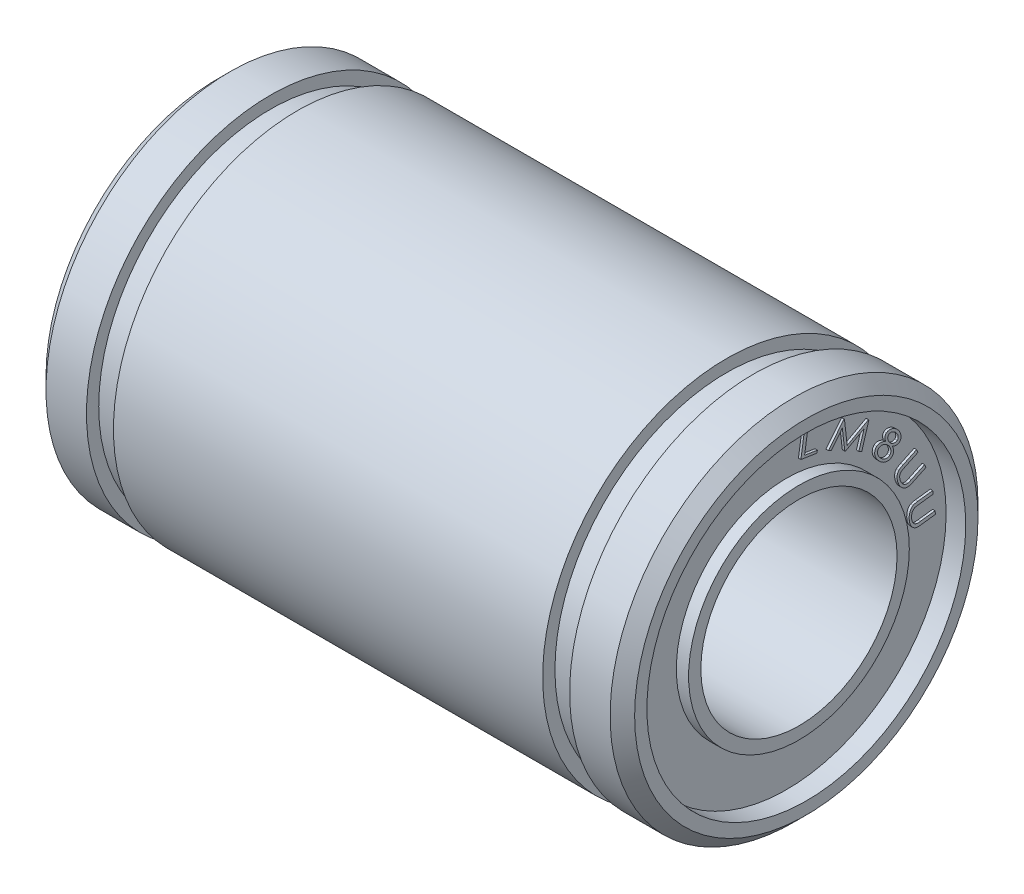
from build123d import *

# Parameters (mm, degrees)
SKETCH2_R                = 7.5
SKETCH2_R_2              = 6.5
BOSS_EXTRUDE1_DEPTH      = 12
BOSS_EXTRUDE2_DEPTH      = 11.2
BOSS_EXTRUDE2_DEPTH_BACK = 11.2
SKETCH3_R                = 6.5
SKETCH3_R_2              = 4.5
BOSS_EXTRUDE3_DEPTH      = 11.7
BOSS_EXTRUDE3_DEPTH_BACK = 11.7
SKETCH4_R                = 4.5
SKETCH4_R_2              = 4
CHAMFER1_SIZE            = 0.5
SKETCH5_W                = 1.1
SKETCH5_H                = 0.5
BOSS_EXTRUDE4_DEPTH      = 0.1
BOSS_EXTRUDE5_DEPTH      = 0.1


with BuildPart() as part:
    # Sketch2 → Boss-Extrude1 (new, symmetric)
    with BuildSketch(Plane(origin=(0, 0, 0), x_dir=(0, 0, -1), z_dir=(1, 0, 0))):
        Circle(SKETCH2_R)
        Circle(SKETCH2_R_2, mode=Mode.SUBTRACT)
    extrude(amount=BOSS_EXTRUDE1_DEPTH, both=True)

    # Sketch3 → Boss-Extrude2 (add, two sides: drawn at the far end of the back side and taken through both)
    with BuildSketch(Plane(origin=(0, 0, 0), x_dir=(0, 0, -1), z_dir=(1, 0, 0)).offset(-BOSS_EXTRUDE2_DEPTH_BACK)):
        Circle(SKETCH3_R)
        with Locations(Location((0, 0, 0), (0, 0, 180))):
            Circle(SKETCH3_R_2, mode=Mode.SUBTRACT)
    extrude(amount=BOSS_EXTRUDE2_DEPTH + BOSS_EXTRUDE2_DEPTH_BACK)

    # Sketch4 → Boss-Extrude3 (add, two sides: drawn at the far end of the back side and taken through both)
    with BuildSketch(Plane(origin=(0, 0, 0), x_dir=(0, 0, -1), z_dir=(1, 0, 0)).offset(-BOSS_EXTRUDE3_DEPTH_BACK)):
        Circle(SKETCH4_R)
        Circle(SKETCH4_R_2, mode=Mode.SUBTRACT)
    extrude(amount=BOSS_EXTRUDE3_DEPTH + BOSS_EXTRUDE3_DEPTH_BACK)

    # Chamfer1
    chamfer1_edges = [part.edges().sort_by_distance(p)[0] for p in [
        (-12, 0, 7.5),
        (12, 0, 7.5),
    ]]
    chamfer(chamfer1_edges, length=CHAMFER1_SIZE)

    # Sketch5 → Cut-Revolve1 (revolve, cut)
    with BuildSketch(Plane.XY, mode=Mode.PRIVATE) as cut_revolve1_sk:
        with Locations((-9.3, 7.25)):
            Rectangle(SKETCH5_W, SKETCH5_H)
        with Locations((9.3, 7.25)):
            Rectangle(SKETCH5_W, SKETCH5_H)
    revolve(cut_revolve1_sk.sketch.rotate(Axis((12, 0, 0), (-1, 0, 0)), 90), axis=Axis((12, 0, 0), (-1, 0, 0)), mode=Mode.SUBTRACT)

    # Sketch6 → Boss-Extrude4 (add)
    # profile 1 of 5: a face of its own
    with BuildSketch(Plane.ZY.offset(11.2)):
        with BuildLine():
            Line((5.852783603, 1.183430266), (5.869610526, 1.0480136))
            Line((5.869610526, 1.0480136), (5.274658603, 0.97389501))
            add(Edge.make_bspline(
                [(5.274658603, 0.97389501), (5.266240128, 0.972863919), (5.250257189, 0.970906336), (5.227658416, 0.967557015), (5.207525068, 0.964862618), (5.189882151, 0.962109642), (5.174767594, 0.959194656), (5.162086399, 0.956951994), (5.152002622, 0.954552314), (5.146180552, 0.952815346), (5.143648987, 0.952060074)],
                knots=[0, 0, 0, 0, 1.531157103, 2.906986272, 4.124266478, 5.198468333, 6.130081346, 6.903215753, 7.523093966, 8, 8, 8, 8], degree=3))
            add(Edge.make_bspline(
                [(5.143648987, 0.952060074), (5.13453567, 0.948898083), (5.116662917, 0.942696886), (5.091961703, 0.929394764), (5.070374356, 0.912652276), (5.050962157, 0.893134808), (5.03456001, 0.869303997), (5.020789861, 0.8409394), (5.00912617, 0.807993132), (4.999809419, 0.771164662), (4.99312128, 0.732178096), (4.989475431, 0.692667611), (4.989082053, 0.653363647), (4.991700096, 0.627460269), (4.993007962, 0.61452001)],
                knots=[0, 0, 0, 0, 0.863893486, 1.694240831, 2.501235341, 3.305538788, 4.152486817, 5.081460783, 6.124810033, 7.280534857, 8.483167108, 9.667377421, 10.834718017, 12, 12, 12, 12], degree=3))
            add(Edge.make_bspline(
                [(4.993007962, 0.61452001), (4.994614029, 0.603464762), (4.997804354, 0.58150438), (5.006041916, 0.549398247), (5.016377661, 0.518189175), (5.02936743, 0.488423533), (5.044177601, 0.460423412), (5.061137472, 0.435080624), (5.079540286, 0.412239037), (5.099817135, 0.392304951), (5.121850981, 0.37535501), (5.145311174, 0.361231075), (5.170454712, 0.350220592), (5.188050201, 0.345346398), (5.196934244, 0.342885395)],
                knots=[0, 0, 0, 0, 1.112395204, 2.209685604, 3.297434079, 4.38510116, 5.441803612, 6.449333861, 7.418822686, 8.359788486, 9.275360939, 10.182481772, 11.082326805, 12, 12, 12, 12], degree=3))
            add(Edge.make_bspline(
                [(5.196934244, 0.342885395), (5.200596565, 0.342148157), (5.208665862, 0.34052378), (5.222156771, 0.339518888), (5.237998971, 0.339129296), (5.256238627, 0.339652533), (5.276949187, 0.34061766), (5.30006052, 0.342451261), (5.325558236, 0.345124637), (5.343304037, 0.347205808), (5.352583282, 0.348294048)],
                knots=[0, 0, 0, 0, 0.573153494, 1.262845552, 2.073082706, 3.006320223, 4.063610556, 5.256519096, 6.565439054, 8, 8, 8, 8], degree=3))
            Line((5.352583282, 0.348294048), (5.947535205, 0.422412638))
            Line((5.947535205, 0.422412638), (5.964562449, 0.286995971))
            Line((5.964562449, 0.286995971), (5.369610526, 0.212877382))
            add(Edge.make_bspline(
                [(5.369610526, 0.212877382), (5.358867234, 0.211671284), (5.337878524, 0.209314984), (5.307076459, 0.207058106), (5.277668671, 0.20630151), (5.249720866, 0.20657026), (5.22318557, 0.208444379), (5.198077279, 0.211318556), (5.174418047, 0.21580393), (5.151903857, 0.221301845), (5.130261232, 0.228836367), (5.109219219, 0.238640728), (5.088731412, 0.25102273), (5.068626497, 0.265565571), (5.048803425, 0.282224344), (5.029280563, 0.301070608), (5.01048668, 0.322541289), (4.991984387, 0.345880789), (4.974508177, 0.371299576), (4.958805909, 0.398567772), (4.944418917, 0.427317135), (4.932055923, 0.457817415), (4.921492575, 0.489974926), (4.912412013, 0.523722563), (4.905253391, 0.559135723), (4.901807833, 0.58338407), (4.900059244, 0.595689882)],
                knots=[0, 0, 0, 0, 1.12111868, 2.190281572, 3.201706995, 4.171302125, 5.087520792, 5.959352604, 6.790580153, 7.583330775, 8.360811272, 9.163212158, 9.986235793, 10.839554322, 11.734190068, 12.66957423, 13.650674517, 14.691104165, 15.757145209, 16.846304983, 17.951917626, 19.088710513, 20.255912591, 21.460320474, 22.711136217, 24, 24, 24, 24], degree=3))
            add(Edge.make_bspline(
                [(4.900059244, 0.595689882), (4.898606441, 0.609100804), (4.895748899, 0.635478972), (4.893541604, 0.674586352), (4.89330056, 0.712430643), (4.895072076, 0.749084489), (4.898905548, 0.784453002), (4.904412906, 0.818601194), (4.91210339, 0.851444299), (4.921594426, 0.88292633), (4.93301684, 0.912667227), (4.945726797, 0.940391544), (4.960113694, 0.965768933), (4.975518983, 0.989146276), (4.993033672, 1.0098598), (5.011582319, 1.028590221), (5.031718684, 1.045020841), (5.046258343, 1.054103757), (5.053504757, 1.058630587)],
                knots=[0, 0, 0, 0, 1.25771018, 2.473811262, 3.650639431, 4.785250235, 5.893675183, 6.9664446, 8.008582003, 9.036768308, 10.030088047, 10.977255682, 11.877778809, 12.748155901, 13.583646823, 14.402569918, 15.203857571, 16, 16, 16, 16], degree=3))
            add(Edge.make_bspline(
                [(5.053504757, 1.058630587), (5.058460561, 1.061345871), (5.069099058, 1.067174702), (5.087388125, 1.074085539), (5.108458163, 1.081185509), (5.132555795, 1.087667958), (5.15966221, 1.093597317), (5.189619906, 1.099482934), (5.222732687, 1.104538275), (5.245807995, 1.107676477), (5.25783168, 1.109311677)],
                knots=[0, 0, 0, 0, 0.64015188, 1.374197451, 2.212343233, 3.162107618, 4.201971045, 5.358912142, 6.623827319, 8, 8, 8, 8], degree=3))
            Line((5.25783168, 1.109311677), (5.852783603, 1.183430266))
        make_face()
    # profile 2 of 5: a face of its own
    with BuildSketch(Plane.ZY.offset(11.2)):
        with BuildLine():
            Line((5.1949903, 2.954849137), (5.253083249, 2.831652022))
            Line((5.253083249, 2.831652022), (4.708211454, 2.574039842))
            add(Edge.make_bspline(
                [(4.708211454, 2.574039842), (4.700525688, 2.570381353), (4.685936805, 2.563436921), (4.665277867, 2.553337005), (4.64686738, 2.544483857), (4.630942378, 2.536193542), (4.617363008, 2.528765851), (4.606009362, 2.522475578), (4.597000085, 2.51706862), (4.592008201, 2.513502324), (4.589822031, 2.511940483)],
                knots=[0, 0, 0, 0, 1.526601971, 2.897748655, 4.124244775, 5.190145003, 6.117233676, 6.90006029, 7.518286969, 8, 8, 8, 8], degree=3))
            add(Edge.make_bspline(
                [(4.589822031, 2.511940483), (4.58208983, 2.506078947), (4.566968017, 2.494615582), (4.547746721, 2.473987106), (4.531983511, 2.451518254), (4.519809783, 2.426621708), (4.511576749, 2.398817195), (4.507197424, 2.367532764), (4.506062292, 2.332548704), (4.508861449, 2.29461771), (4.514709721, 2.255490067), (4.523809404, 2.216856999), (4.535647214, 2.179437906), (4.546134945, 2.155619154), (4.551360493, 2.143751381)],
                knots=[0, 0, 0, 0, 0.867002332, 1.695590419, 2.511190631, 3.315637339, 4.164470842, 5.09494713, 6.135349929, 7.291287823, 8.493904131, 9.672344479, 10.840237755, 12, 12, 12, 12], degree=3))
            add(Edge.make_bspline(
                [(4.551360493, 2.143751381), (4.556390688, 2.133702323), (4.5663414, 2.113823316), (4.584333989, 2.085871772), (4.603784295, 2.059372583), (4.625427507, 2.035030983), (4.648333584, 2.013050594), (4.672637656, 1.994438798), (4.697199699, 1.978300582), (4.722834629, 1.965908507), (4.749053316, 1.956450992), (4.775944377, 1.950803306), (4.803383103, 1.947890299), (4.821723246, 1.948919468), (4.831007929, 1.949440483)],
                knots=[0, 0, 0, 0, 1.115688134, 2.207049909, 3.297665439, 4.378553269, 5.439054465, 6.446196602, 7.415962669, 8.35349526, 9.268291365, 10.177804537, 11.077515089, 12, 12, 12, 12], degree=3))
            add(Edge.make_bspline(
                [(4.831007929, 1.949440483), (4.834762282, 1.949894682), (4.843023816, 1.950894155), (4.856179118, 1.954429466), (4.871586823, 1.958687976), (4.888768805, 1.965092281), (4.9082489, 1.972513533), (4.929679079, 1.981498306), (4.953213785, 1.992005649), (4.969506099, 1.999565631), (4.978043185, 2.003527022)],
                knots=[0, 0, 0, 0, 0.576626743, 1.268879095, 2.075383897, 3.016827495, 4.065561191, 5.25819098, 6.563306669, 8, 8, 8, 8], degree=3))
            Line((4.978043185, 2.003527022), (5.52291498, 2.261139201))
            Line((5.52291498, 2.261139201), (5.581208249, 2.137942086))
            Line((5.581208249, 2.137942086), (5.036336454, 1.880329906))
            add(Edge.make_bspline(
                [(5.036336454, 1.880329906), (5.026486559, 1.875782417), (5.007201544, 1.866878932), (4.978411586, 1.855081114), (4.950614437, 1.845028535), (4.923711689, 1.836782543), (4.897886145, 1.829922803), (4.872944073, 1.824831179), (4.848978078, 1.821645951), (4.825765416, 1.819901881), (4.802808619, 1.820207044), (4.779754763, 1.823175696), (4.756359877, 1.828166998), (4.73256424, 1.835456479), (4.708500054, 1.845087508), (4.684201705, 1.857334618), (4.659347278, 1.871471926), (4.634446015, 1.888062398), (4.6098916, 1.906790794), (4.586239106, 1.927650315), (4.563680759, 1.950558009), (4.542519128, 1.975743702), (4.52215442, 2.002790968), (4.503255072, 2.032172478), (4.485084338, 2.063369036), (4.474305393, 2.085321399), (4.468828441, 2.09647574)],
                knots=[0, 0, 0, 0, 1.122329607, 2.197398293, 3.217899131, 4.179380452, 5.107677168, 5.981552748, 6.811047209, 7.607430596, 8.38819948, 9.181671035, 10.008197087, 10.860479187, 11.753345179, 12.686385394, 13.673510063, 14.710088981, 15.779549503, 16.866164986, 17.970209254, 19.102445698, 20.26719891, 21.470546206, 22.714744744, 24, 24, 24, 24], degree=3))
            add(Edge.make_bspline(
                [(4.468828441, 2.09647574), (4.463236837, 2.108778742), (4.452247051, 2.132959165), (4.438003032, 2.169532685), (4.426027259, 2.205515969), (4.416022352, 2.240897488), (4.408696016, 2.275719226), (4.403385384, 2.309952665), (4.400377454, 2.343609942), (4.399547642, 2.376533499), (4.400902354, 2.408332425), (4.404430057, 2.438619807), (4.410278504, 2.467214077), (4.418089471, 2.494154182), (4.427812027, 2.519530685), (4.439945774, 2.543020554), (4.453937899, 2.564977394), (4.465067018, 2.578097216), (4.470631326, 2.58465683)],
                knots=[0, 0, 0, 0, 1.258098567, 2.47267724, 3.652303055, 4.788141768, 5.894117424, 6.963326746, 8.011966988, 9.038102082, 10.027590266, 10.973030082, 11.87409143, 12.741760367, 13.582275377, 14.399756918, 15.199914691, 16, 16, 16, 16], degree=3))
            add(Edge.make_bspline(
                [(4.470631326, 2.58465683), (4.474554723, 2.588818637), (4.482969471, 2.597744718), (4.498333358, 2.610123911), (4.516092249, 2.623727072), (4.537194851, 2.637324731), (4.561166017, 2.651647235), (4.588184165, 2.666306391), (4.618068893, 2.681808181), (4.639139434, 2.691951601), (4.650118505, 2.697236958)],
                knots=[0, 0, 0, 0, 0.643772035, 1.380736863, 2.21890818, 3.16423712, 4.206842921, 5.365167413, 6.627087258, 8, 8, 8, 8], degree=3))
            Line((4.650118505, 2.697236958), (5.1949903, 2.954849137))
        make_face()
    # profile 3 of 5: a face of its own
    with BuildSketch(Plane.ZY.offset(11.2)):
        with BuildLine():
            add(Edge.make_bspline(
                [(4.210172993, 3.574370887), (4.214630345, 3.563397169), (4.223284446, 3.542091321), (4.233948563, 3.510372512), (4.243088319, 3.480357414), (4.250230657, 3.451758141), (4.25514951, 3.424576938), (4.258592429, 3.398916083), (4.259525833, 3.37471957), (4.258792779, 3.35194566), (4.256240779, 3.330411397), (4.251734084, 3.309997219), (4.245778041, 3.290532472), (4.23811036, 3.272037388), (4.228973264, 3.25447204), (4.217707798, 3.238212337), (4.205183992, 3.222591846), (4.195459976, 3.213290326), (4.190541582, 3.20858563)],
                knots=[0, 0, 0, 0, 1.44955035, 2.814351453, 4.094403086, 5.289816763, 6.420076562, 7.474462587, 8.456167334, 9.380383044, 10.261408924, 11.106318522, 11.936229004, 12.749838444, 13.554239798, 14.354519299, 15.167718053, 16, 16, 16, 16], degree=3))
            add(Edge.make_bspline(
                [(4.190541582, 3.20858563), (4.183342877, 3.202384215), (4.169062415, 3.190082131), (4.145181125, 3.175108072), (4.119906819, 3.162967004), (4.093104759, 3.153689379), (4.064726208, 3.147497624), (4.034845663, 3.144419212), (4.003443768, 3.143885949), (3.98213011, 3.146001434), (3.971190621, 3.147087233)],
                knots=[0, 0, 0, 0, 0.967600255, 1.919481046, 2.863440767, 3.821533868, 4.804390076, 5.817846704, 6.879983798, 8, 8, 8, 8], degree=3))
            add(Edge.make_bspline(
                [(3.971190621, 3.147087233), (3.957429969, 3.149227449), (3.929667243, 3.15354543), (3.888707875, 3.166271967), (3.847929142, 3.183264625), (3.807539098, 3.205471574), (3.767163762, 3.231908882), (3.727268162, 3.263458703), (3.687513706, 3.299547486), (3.662255398, 3.326265782), (3.649275557, 3.339995887)],
                knots=[0, 0, 0, 0, 0.871235448, 1.757756195, 2.678197, 3.634502803, 4.640226112, 5.697766159, 6.816918833, 8, 8, 8, 8], degree=3))
            add(Edge.make_bspline(
                [(3.649275557, 3.339995887), (3.637141026, 3.353666176), (3.613619081, 3.380165081), (3.582372553, 3.421222193), (3.555242819, 3.461462858), (3.532939632, 3.501437136), (3.514947983, 3.540798181), (3.501284946, 3.57963809), (3.492376441, 3.618076959), (3.488082798, 3.655719102), (3.487326545, 3.691853712), (3.489383952, 3.725995436), (3.494600947, 3.757870852), (3.502600393, 3.787492684), (3.513324583, 3.814980497), (3.527369194, 3.839977012), (3.543962561, 3.863024373), (3.557393993, 3.876231685), (3.564139339, 3.882864476)],
                knots=[0, 0, 0, 0, 1.44102328, 2.793323338, 4.065377375, 5.265249014, 6.398752964, 7.474536514, 8.506634203, 9.503347757, 10.456678685, 11.353725829, 12.196901549, 12.999110117, 13.769636829, 14.516870557, 15.255163551, 16, 16, 16, 16], degree=3))
            add(Edge.make_bspline(
                [(3.564139339, 3.882864476), (3.569323982, 3.887386128), (3.579621339, 3.896366699), (3.59656267, 3.907729136), (3.614347002, 3.917410122), (3.632930501, 3.925518333), (3.652537118, 3.931418914), (3.672878097, 3.935928427), (3.694211395, 3.938490321), (3.716516598, 3.939219033), (3.739997294, 3.938343427), (3.764670679, 3.934681648), (3.790786362, 3.929307755), (3.818260485, 3.921587626), (3.847137412, 3.911728353), (3.877294743, 3.899628826), (3.90897296, 3.885602827), (3.930174203, 3.874820735), (3.941142544, 3.869242681)],
                knots=[0, 0, 0, 0, 0.817538492, 1.62373468, 2.419814391, 3.223817057, 4.030169697, 4.851095687, 5.699229519, 6.581337039, 7.503436561, 8.489558822, 9.544019967, 10.673119246, 11.881128513, 13.171536168, 14.53671057, 16, 16, 16, 16], degree=3))
            add(Edge.make_bspline(
                [(3.941142544, 3.869242681), (3.938065934, 3.877363479), (3.932056255, 3.893226193), (3.924435861, 3.916957067), (3.918184666, 3.939864355), (3.913539156, 3.962079817), (3.910335037, 3.983482198), (3.908419246, 4.004152022), (3.908265137, 4.024041289), (3.909404504, 4.043132547), (3.912061476, 4.061328346), (3.915737269, 4.078671327), (3.921139386, 4.094916886), (3.927120789, 4.110430365), (3.934952708, 4.124732974), (3.943650329, 4.138178351), (3.953804594, 4.150538773), (3.961372458, 4.157970563), (3.965181006, 4.16171063)],
                knots=[0, 0, 0, 0, 1.334713297, 2.607154434, 3.829682964, 4.983172095, 6.093662305, 7.154912732, 8.171129541, 9.148180218, 10.091713838, 10.99572943, 11.868918541, 12.720916661, 13.547494991, 14.370240634, 15.179819431, 16, 16, 16, 16], degree=3))
            add(Edge.make_bspline(
                [(3.965181006, 4.16171063), (3.969314154, 4.165276513), (3.97757301, 4.17240186), (3.991321665, 4.181432158), (4.006118686, 4.188964762), (4.021720329, 4.195814204), (4.038702345, 4.200558014), (4.056510776, 4.204713334), (4.075421795, 4.207265718), (4.095237496, 4.208359348), (4.115651546, 4.208477449), (4.136480051, 4.206821564), (4.157538096, 4.203537858), (4.178885106, 4.198962806), (4.200448609, 4.192936487), (4.222168574, 4.185242955), (4.244137988, 4.176008565), (4.27389278, 4.161768381), (4.310542712, 4.141122241), (4.352346035, 4.111519728), (4.392492978, 4.077990149), (4.416807877, 4.052450756), (4.429123313, 4.039515117)],
                knots=[0, 0, 0, 0, 0.622034245, 1.242948883, 1.869626625, 2.514544104, 3.181907857, 3.876518595, 4.599114658, 5.354354804, 6.138670592, 6.925348559, 7.734123211, 8.567508609, 9.413701997, 10.285512202, 11.193421449, 12.130062518, 14.046446254, 15.981543311, 17.964661662, 20, 20, 20, 20], degree=3))
            add(Edge.make_bspline(
                [(4.429123313, 4.039515117), (4.440539519, 4.026438616), (4.463072838, 4.000628202), (4.491841192, 3.95876655), (4.516117582, 3.915375589), (4.535630256, 3.870905213), (4.550038334, 3.826345413), (4.559206403, 3.782695575), (4.56223375, 3.740390328), (4.560214213, 3.706237009), (4.555565386, 3.680270896), (4.551035584, 3.661903719), (4.545246251, 3.644597619), (4.538123045, 3.628420099), (4.530000287, 3.61320384), (4.520495207, 3.599026754), (4.509671841, 3.586013522), (4.501640252, 3.578112663), (4.497632929, 3.574170566)],
                knots=[0, 0, 0, 0, 1.60990914, 3.177640475, 4.703475317, 6.218639192, 7.676713618, 9.042755577, 10.347441643, 11.601825723, 12.205993714, 12.793664293, 13.356091324, 13.897221279, 14.432356731, 14.954856267, 15.478530456, 16, 16, 16, 16], degree=3))
            add(Edge.make_bspline(
                [(4.497632929, 3.574170566), (4.493419574, 3.570556304), (4.485014889, 3.563346674), (4.471433901, 3.553951253), (4.45709876, 3.546114653), (4.442157674, 3.539643908), (4.426541847, 3.534584289), (4.41012772, 3.53129907), (4.393137163, 3.528971725), (4.375430191, 3.52848456), (4.357088279, 3.529297565), (4.338080933, 3.531530302), (4.318413891, 3.535164855), (4.298095681, 3.540238343), (4.27704384, 3.546683598), (4.255252334, 3.554502399), (4.232783088, 3.56370719), (4.217821373, 3.570763648), (4.210172993, 3.574370887)],
                knots=[0, 0, 0, 0, 0.869282886, 1.734021791, 2.581439237, 3.424843839, 4.281700514, 5.147514454, 6.044126873, 6.965242563, 7.91812612, 8.918574964, 9.960916807, 11.049378877, 12.197677358, 13.408732993, 14.675352794, 16, 16, 16, 16], degree=3))
        make_face()
        with BuildLine():
            add(Edge.make_bspline(
                [(4.353201839, 3.979018322), (4.346925732, 3.985628126), (4.334630089, 3.998577519), (4.315405271, 4.016505142), (4.295686675, 4.032286509), (4.275848562, 4.046538909), (4.255450136, 4.058433942), (4.234849767, 4.068596192), (4.213945778, 4.07684079), (4.19290545, 4.083193932), (4.172274461, 4.087645729), (4.152540546, 4.08988211), (4.133943063, 4.090141605), (4.116358626, 4.08842822), (4.099908365, 4.084428401), (4.084579947, 4.078331855), (4.07039931, 4.070072485), (4.061978142, 4.063076915), (4.057729082, 4.059547169)],
                knots=[0, 0, 0, 0, 1.298124085, 2.543179939, 3.740382283, 4.893556371, 6.019061523, 7.09945913, 8.162682028, 9.215774896, 10.226797017, 11.164717978, 12.039772105, 12.871635768, 13.674391456, 14.442657599, 15.214213473, 16, 16, 16, 16], degree=3))
            add(Edge.make_bspline(
                [(4.057729082, 4.059547169), (4.053861336, 4.055650668), (4.046098095, 4.047829713), (4.036733985, 4.034035555), (4.029182717, 4.018821693), (4.023861395, 4.001979593), (4.020227439, 3.983644893), (4.018720507, 3.963687279), (4.019170816, 3.942229093), (4.021676472, 3.919611611), (4.025678893, 3.896446337), (4.032043167, 3.873605591), (4.039829303, 3.851202938), (4.049540827, 3.829338194), (4.060829951, 3.80783548), (4.074511456, 3.787241198), (4.089463783, 3.766839786), (4.100700148, 3.753979433), (4.106406967, 3.74744781)],
                knots=[0, 0, 0, 0, 0.762191197, 1.529850645, 2.306501283, 3.117057933, 3.9785243, 4.900907606, 5.894761445, 6.959297982, 8.063208751, 9.160340868, 10.252943674, 11.359000803, 12.484880561, 13.625977656, 14.794261766, 16, 16, 16, 16], degree=3))
            add(Edge.make_bspline(
                [(4.106406967, 3.74744781), (4.114065441, 3.739472531), (4.129285832, 3.723622526), (4.154655496, 3.702902857), (4.181500114, 3.684660153), (4.209660622, 3.669367621), (4.238426042, 3.657352673), (4.267125899, 3.649129876), (4.295303565, 3.645096099), (4.322526351, 3.644847969), (4.348041647, 3.648139513), (4.371077363, 3.654723805), (4.391590717, 3.664273109), (4.402906106, 3.673421714), (4.4084903, 3.677936592)],
                knots=[0, 0, 0, 0, 1.169442566, 2.324141052, 3.459139556, 4.600808126, 5.709896512, 6.752567757, 7.752091318, 8.71332435, 9.625933698, 10.464729916, 11.242337406, 12, 12, 12, 12], degree=3))
            add(Edge.make_bspline(
                [(4.4084903, 3.677936592), (4.412091359, 3.68143116), (4.41927742, 3.688404716), (4.427828648, 3.700976628), (4.435139864, 3.714543039), (4.440526791, 3.72961943), (4.444292028, 3.745888323), (4.446474392, 3.763476113), (4.446989517, 3.782378079), (4.446041767, 3.802492462), (4.443064967, 3.823521027), (4.437659736, 3.845045312), (4.429448399, 3.866666972), (4.419216716, 3.88871679), (4.406225598, 3.910907059), (4.39102677, 3.93361481), (4.373069115, 3.956390404), (4.359949483, 3.971333064), (4.353201839, 3.979018322)],
                knots=[0, 0, 0, 0, 0.711682619, 1.420192318, 2.15062308, 2.898429337, 3.688260017, 4.520754515, 5.413581114, 6.373580811, 7.380499643, 8.428125446, 9.521466003, 10.663903564, 11.880271886, 13.173072711, 14.546064374, 16, 16, 16, 16], degree=3))
        make_face(mode=Mode.SUBTRACT)
        with BuildLine():
            add(Edge.make_bspline(
                [(4.04110248, 3.685348451), (4.033186632, 3.693658053), (4.017672817, 3.709943565), (3.993128412, 3.732337379), (3.967869862, 3.752093819), (3.942198881, 3.769780032), (3.915678694, 3.784510242), (3.88868001, 3.797101945), (3.861073151, 3.807137452), (3.8331414, 3.814433238), (3.805822642, 3.819444996), (3.779607944, 3.822028794), (3.754882349, 3.821639344), (3.731607608, 3.818689078), (3.709785376, 3.813060748), (3.689370218, 3.804852268), (3.670488954, 3.793797527), (3.659431981, 3.784410423), (3.653882929, 3.779699412)],
                knots=[0, 0, 0, 0, 1.255674536, 2.460924376, 3.631837996, 4.762760054, 5.868544453, 6.947443884, 8.019989786, 9.078125997, 10.102937184, 11.056915449, 11.955823424, 12.803272986, 13.618544949, 14.415066428, 15.204585384, 16, 16, 16, 16], degree=3))
            add(Edge.make_bspline(
                [(3.653882929, 3.779699412), (3.64755204, 3.773166319), (3.634863259, 3.760072266), (3.620178564, 3.736206736), (3.610173044, 3.708995836), (3.603767779, 3.679128327), (3.601720133, 3.647107976), (3.60502786, 3.61369414), (3.612703815, 3.579235324), (3.625343959, 3.543962844), (3.642348951, 3.508167539), (3.664099626, 3.472487777), (3.689674483, 3.436547623), (3.709685951, 3.413936648), (3.719988698, 3.402295566)],
                knots=[0, 0, 0, 0, 0.771791342, 1.546874631, 2.3608388, 3.226012444, 4.136118452, 5.076700301, 6.071162967, 7.130513777, 8.255465151, 9.434509802, 10.679177577, 12, 12, 12, 12], degree=3))
            add(Edge.make_bspline(
                [(3.719988698, 3.402295566), (3.728298296, 3.393510364), (3.744533662, 3.376345759), (3.77001361, 3.352998746), (3.795405038, 3.332058278), (3.821489153, 3.314520988), (3.847390925, 3.299066178), (3.873751262, 3.286865215), (3.900222779, 3.277301649), (3.926676094, 3.270578987), (3.952554483, 3.266348868), (3.977383192, 3.264636789), (4.000826906, 3.265617018), (4.02295064, 3.269001037), (4.043739807, 3.274849652), (4.063292788, 3.283002679), (4.081453937, 3.293962285), (4.092169722, 3.303113137), (4.097592865, 3.307744284)],
                knots=[0, 0, 0, 0, 1.347039667, 2.631857821, 3.848511206, 5.010397929, 6.130830263, 7.20602828, 8.241569092, 9.262979973, 10.242784583, 11.159900389, 12.031234029, 12.852053592, 13.648222388, 14.431775035, 15.20633839, 16, 16, 16, 16], degree=3))
            add(Edge.make_bspline(
                [(4.097592865, 3.307744284), (4.102503395, 3.312537637), (4.112329123, 3.322128898), (4.124038712, 3.339219557), (4.133565821, 3.357790504), (4.140642817, 3.378144974), (4.145168288, 3.400237482), (4.147243468, 3.424080254), (4.147304718, 3.449636744), (4.144515775, 3.476548035), (4.139886575, 3.504189407), (4.132583276, 3.531631394), (4.123154752, 3.558657749), (4.111283295, 3.585086021), (4.097150342, 3.611021987), (4.080923159, 3.636529889), (4.062214026, 3.66149311), (4.048227644, 3.677297254), (4.04110248, 3.685348451)],
                knots=[0, 0, 0, 0, 0.784478123, 1.569701805, 2.359976643, 3.170430092, 4.030075566, 4.936633935, 5.908124575, 6.953203035, 8.03222106, 9.115784845, 10.202045408, 11.308057782, 12.430768399, 13.583032808, 14.768710361, 16, 16, 16, 16], degree=3))
        make_face(mode=Mode.SUBTRACT)
    # profile 4 of 5: a face of its own
    with BuildSketch(Plane.ZY.offset(11.2)):
        Polygon((1.601520085, 4.718597961), (2.234933546, 5.513069115), (2.254564957, 5.502852769), (2.365742841, 4.521081935), (3.230526495, 4.992436102), (3.250157905, 4.982219756), (2.961095405, 4.007660461), (2.842105021, 4.06996014), (3.054645085, 4.763870397), (2.297633867, 4.354615589), (2.267385469, 4.37044091), (2.168226815, 5.233421679), (1.717906303, 4.657700525), align=None)
    # profile 5 of 5: a face of its own
    with BuildSketch(Plane.ZY.offset(11.2)):
        Polygon((0.628059226, 5.950645023), (0.764277175, 5.93001201), (0.62966179, 5.039787651), (1.149693841, 4.961061689), (1.135270764, 4.865909446), (0.479020764, 4.96526842), align=None)
    extrude(amount=BOSS_EXTRUDE4_DEPTH)

    # Sketch7 → Boss-Extrude5 (add)
    # profile 1 of 5: a face of its own
    with BuildSketch(Plane(origin=(11.2, 0, 0), x_dir=(0, 0, -1), z_dir=(1, 0, 0))):
        with BuildLine():
            Line((5.852783603, 1.183430266), (5.869610526, 1.0480136))
            Line((5.869610526, 1.0480136), (5.274658603, 0.97389501))
            add(Edge.make_bspline(
                [(5.274658603, 0.97389501), (5.266240128, 0.972863919), (5.250257189, 0.970906336), (5.227658416, 0.967557015), (5.207525068, 0.964862618), (5.189882151, 0.962109642), (5.174767594, 0.959194656), (5.162086399, 0.956951994), (5.152002622, 0.954552314), (5.146180552, 0.952815346), (5.143648987, 0.952060074)],
                knots=[0, 0, 0, 0, 1.531157103, 2.906986272, 4.124266478, 5.198468333, 6.130081346, 6.903215753, 7.523093966, 8, 8, 8, 8], degree=3))
            add(Edge.make_bspline(
                [(5.143648987, 0.952060074), (5.13453567, 0.948898083), (5.116662917, 0.942696886), (5.091961703, 0.929394764), (5.070374356, 0.912652276), (5.050962157, 0.893134808), (5.03456001, 0.869303997), (5.020789861, 0.8409394), (5.00912617, 0.807993132), (4.999809419, 0.771164662), (4.99312128, 0.732178096), (4.989475431, 0.692667611), (4.989082053, 0.653363647), (4.991700096, 0.627460269), (4.993007962, 0.61452001)],
                knots=[0, 0, 0, 0, 0.863893486, 1.694240831, 2.501235341, 3.305538788, 4.152486817, 5.081460783, 6.124810033, 7.280534857, 8.483167108, 9.667377421, 10.834718017, 12, 12, 12, 12], degree=3))
            add(Edge.make_bspline(
                [(4.993007962, 0.61452001), (4.994614029, 0.603464762), (4.997804354, 0.58150438), (5.006041916, 0.549398247), (5.016377661, 0.518189175), (5.02936743, 0.488423533), (5.044177601, 0.460423412), (5.061137472, 0.435080624), (5.079540286, 0.412239037), (5.099817135, 0.392304951), (5.121850981, 0.37535501), (5.145311174, 0.361231075), (5.170454712, 0.350220592), (5.188050201, 0.345346398), (5.196934244, 0.342885395)],
                knots=[0, 0, 0, 0, 1.112395204, 2.209685604, 3.297434079, 4.38510116, 5.441803612, 6.449333861, 7.418822686, 8.359788486, 9.275360939, 10.182481772, 11.082326805, 12, 12, 12, 12], degree=3))
            add(Edge.make_bspline(
                [(5.196934244, 0.342885395), (5.200596565, 0.342148157), (5.208665862, 0.34052378), (5.222156771, 0.339518888), (5.237998971, 0.339129296), (5.256238627, 0.339652533), (5.276949187, 0.34061766), (5.30006052, 0.342451261), (5.325558236, 0.345124637), (5.343304037, 0.347205808), (5.352583282, 0.348294048)],
                knots=[0, 0, 0, 0, 0.573153494, 1.262845552, 2.073082706, 3.006320223, 4.063610556, 5.256519096, 6.565439054, 8, 8, 8, 8], degree=3))
            Line((5.352583282, 0.348294048), (5.947535205, 0.422412638))
            Line((5.947535205, 0.422412638), (5.964562449, 0.286995971))
            Line((5.964562449, 0.286995971), (5.369610526, 0.212877382))
            add(Edge.make_bspline(
                [(5.369610526, 0.212877382), (5.358867234, 0.211671284), (5.337878524, 0.209314984), (5.307076459, 0.207058106), (5.277668671, 0.20630151), (5.249720866, 0.20657026), (5.22318557, 0.208444379), (5.198077279, 0.211318556), (5.174418047, 0.21580393), (5.151903857, 0.221301845), (5.130261232, 0.228836367), (5.109219219, 0.238640728), (5.088731412, 0.25102273), (5.068626497, 0.265565571), (5.048803425, 0.282224344), (5.029280563, 0.301070608), (5.01048668, 0.322541289), (4.991984387, 0.345880789), (4.974508177, 0.371299576), (4.958805909, 0.398567772), (4.944418917, 0.427317135), (4.932055923, 0.457817415), (4.921492575, 0.489974926), (4.912412013, 0.523722563), (4.905253391, 0.559135723), (4.901807833, 0.58338407), (4.900059244, 0.595689882)],
                knots=[0, 0, 0, 0, 1.12111868, 2.190281572, 3.201706995, 4.171302125, 5.087520792, 5.959352604, 6.790580153, 7.583330775, 8.360811272, 9.163212158, 9.986235793, 10.839554322, 11.734190068, 12.66957423, 13.650674517, 14.691104165, 15.757145209, 16.846304983, 17.951917626, 19.088710513, 20.255912591, 21.460320474, 22.711136217, 24, 24, 24, 24], degree=3))
            add(Edge.make_bspline(
                [(4.900059244, 0.595689882), (4.898606441, 0.609100804), (4.895748899, 0.635478972), (4.893541604, 0.674586352), (4.89330056, 0.712430643), (4.895072076, 0.749084489), (4.898905548, 0.784453002), (4.904412906, 0.818601194), (4.91210339, 0.851444299), (4.921594426, 0.88292633), (4.93301684, 0.912667227), (4.945726797, 0.940391544), (4.960113694, 0.965768933), (4.975518983, 0.989146276), (4.993033672, 1.0098598), (5.011582319, 1.028590221), (5.031718684, 1.045020841), (5.046258343, 1.054103757), (5.053504757, 1.058630587)],
                knots=[0, 0, 0, 0, 1.25771018, 2.473811262, 3.650639431, 4.785250235, 5.893675183, 6.9664446, 8.008582003, 9.036768308, 10.030088047, 10.977255682, 11.877778809, 12.748155901, 13.583646823, 14.402569918, 15.203857571, 16, 16, 16, 16], degree=3))
            add(Edge.make_bspline(
                [(5.053504757, 1.058630587), (5.058460561, 1.061345871), (5.069099058, 1.067174702), (5.087388125, 1.074085539), (5.108458163, 1.081185509), (5.132555795, 1.087667958), (5.15966221, 1.093597317), (5.189619906, 1.099482934), (5.222732687, 1.104538275), (5.245807995, 1.107676477), (5.25783168, 1.109311677)],
                knots=[0, 0, 0, 0, 0.64015188, 1.374197451, 2.212343233, 3.162107618, 4.201971045, 5.358912142, 6.623827319, 8, 8, 8, 8], degree=3))
            Line((5.25783168, 1.109311677), (5.852783603, 1.183430266))
        make_face()
    # profile 2 of 5: a face of its own
    with BuildSketch(Plane(origin=(11.2, 0, 0), x_dir=(0, 0, -1), z_dir=(1, 0, 0))):
        with BuildLine():
            Line((5.1949903, 2.954849137), (5.253083249, 2.831652022))
            Line((5.253083249, 2.831652022), (4.708211454, 2.574039842))
            add(Edge.make_bspline(
                [(4.708211454, 2.574039842), (4.700525688, 2.570381353), (4.685936805, 2.563436921), (4.665277867, 2.553337005), (4.64686738, 2.544483857), (4.630942378, 2.536193542), (4.617363008, 2.528765851), (4.606009362, 2.522475578), (4.597000085, 2.51706862), (4.592008201, 2.513502324), (4.589822031, 2.511940483)],
                knots=[0, 0, 0, 0, 1.526601971, 2.897748655, 4.124244775, 5.190145003, 6.117233676, 6.90006029, 7.518286969, 8, 8, 8, 8], degree=3))
            add(Edge.make_bspline(
                [(4.589822031, 2.511940483), (4.58208983, 2.506078947), (4.566968017, 2.494615582), (4.547746721, 2.473987106), (4.531983511, 2.451518254), (4.519809783, 2.426621708), (4.511576749, 2.398817195), (4.507197424, 2.367532764), (4.506062292, 2.332548704), (4.508861449, 2.29461771), (4.514709721, 2.255490067), (4.523809404, 2.216856999), (4.535647214, 2.179437906), (4.546134945, 2.155619154), (4.551360493, 2.143751381)],
                knots=[0, 0, 0, 0, 0.867002332, 1.695590419, 2.511190631, 3.315637339, 4.164470842, 5.09494713, 6.135349929, 7.291287823, 8.493904131, 9.672344479, 10.840237755, 12, 12, 12, 12], degree=3))
            add(Edge.make_bspline(
                [(4.551360493, 2.143751381), (4.556390688, 2.133702323), (4.5663414, 2.113823316), (4.584333989, 2.085871772), (4.603784295, 2.059372583), (4.625427507, 2.035030983), (4.648333584, 2.013050594), (4.672637656, 1.994438798), (4.697199699, 1.978300582), (4.722834629, 1.965908507), (4.749053316, 1.956450992), (4.775944377, 1.950803306), (4.803383103, 1.947890299), (4.821723246, 1.948919468), (4.831007929, 1.949440483)],
                knots=[0, 0, 0, 0, 1.115688134, 2.207049909, 3.297665439, 4.378553269, 5.439054465, 6.446196602, 7.415962669, 8.35349526, 9.268291365, 10.177804537, 11.077515089, 12, 12, 12, 12], degree=3))
            add(Edge.make_bspline(
                [(4.831007929, 1.949440483), (4.834762282, 1.949894682), (4.843023816, 1.950894155), (4.856179118, 1.954429466), (4.871586823, 1.958687976), (4.888768805, 1.965092281), (4.9082489, 1.972513533), (4.929679079, 1.981498306), (4.953213785, 1.992005649), (4.969506099, 1.999565631), (4.978043185, 2.003527022)],
                knots=[0, 0, 0, 0, 0.576626743, 1.268879095, 2.075383897, 3.016827495, 4.065561191, 5.25819098, 6.563306669, 8, 8, 8, 8], degree=3))
            Line((4.978043185, 2.003527022), (5.52291498, 2.261139201))
            Line((5.52291498, 2.261139201), (5.581208249, 2.137942086))
            Line((5.581208249, 2.137942086), (5.036336454, 1.880329906))
            add(Edge.make_bspline(
                [(5.036336454, 1.880329906), (5.026486559, 1.875782417), (5.007201544, 1.866878932), (4.978411586, 1.855081114), (4.950614437, 1.845028535), (4.923711689, 1.836782543), (4.897886145, 1.829922803), (4.872944073, 1.824831179), (4.848978078, 1.821645951), (4.825765416, 1.819901881), (4.802808619, 1.820207044), (4.779754763, 1.823175696), (4.756359877, 1.828166998), (4.73256424, 1.835456479), (4.708500054, 1.845087508), (4.684201705, 1.857334618), (4.659347278, 1.871471926), (4.634446015, 1.888062398), (4.6098916, 1.906790794), (4.586239106, 1.927650315), (4.563680759, 1.950558009), (4.542519128, 1.975743702), (4.52215442, 2.002790968), (4.503255072, 2.032172478), (4.485084338, 2.063369036), (4.474305393, 2.085321399), (4.468828441, 2.09647574)],
                knots=[0, 0, 0, 0, 1.122329607, 2.197398293, 3.217899131, 4.179380452, 5.107677168, 5.981552748, 6.811047209, 7.607430596, 8.38819948, 9.181671035, 10.008197087, 10.860479187, 11.753345179, 12.686385394, 13.673510063, 14.710088981, 15.779549503, 16.866164986, 17.970209254, 19.102445698, 20.26719891, 21.470546206, 22.714744744, 24, 24, 24, 24], degree=3))
            add(Edge.make_bspline(
                [(4.468828441, 2.09647574), (4.463236837, 2.108778742), (4.452247051, 2.132959165), (4.438003032, 2.169532685), (4.426027259, 2.205515969), (4.416022352, 2.240897488), (4.408696016, 2.275719226), (4.403385384, 2.309952665), (4.400377454, 2.343609942), (4.399547642, 2.376533499), (4.400902354, 2.408332425), (4.404430057, 2.438619807), (4.410278504, 2.467214077), (4.418089471, 2.494154182), (4.427812027, 2.519530685), (4.439945774, 2.543020554), (4.453937899, 2.564977394), (4.465067018, 2.578097216), (4.470631326, 2.58465683)],
                knots=[0, 0, 0, 0, 1.258098567, 2.47267724, 3.652303055, 4.788141768, 5.894117424, 6.963326746, 8.011966988, 9.038102082, 10.027590266, 10.973030082, 11.87409143, 12.741760367, 13.582275377, 14.399756918, 15.199914691, 16, 16, 16, 16], degree=3))
            add(Edge.make_bspline(
                [(4.470631326, 2.58465683), (4.474554723, 2.588818637), (4.482969471, 2.597744718), (4.498333358, 2.610123911), (4.516092249, 2.623727072), (4.537194851, 2.637324731), (4.561166017, 2.651647235), (4.588184165, 2.666306391), (4.618068893, 2.681808181), (4.639139434, 2.691951601), (4.650118505, 2.697236958)],
                knots=[0, 0, 0, 0, 0.643772035, 1.380736863, 2.21890818, 3.16423712, 4.206842921, 5.365167413, 6.627087258, 8, 8, 8, 8], degree=3))
            Line((4.650118505, 2.697236958), (5.1949903, 2.954849137))
        make_face()
    # profile 3 of 5: a face of its own
    with BuildSketch(Plane(origin=(11.2, 0, 0), x_dir=(0, 0, -1), z_dir=(1, 0, 0))):
        with BuildLine():
            add(Edge.make_bspline(
                [(4.210172993, 3.574370887), (4.214630345, 3.563397169), (4.223284446, 3.542091321), (4.233948563, 3.510372512), (4.243088319, 3.480357414), (4.250230657, 3.451758141), (4.25514951, 3.424576938), (4.258592429, 3.398916083), (4.259525833, 3.37471957), (4.258792779, 3.35194566), (4.256240779, 3.330411397), (4.251734084, 3.309997219), (4.245778041, 3.290532472), (4.23811036, 3.272037388), (4.228973264, 3.25447204), (4.217707798, 3.238212337), (4.205183992, 3.222591846), (4.195459976, 3.213290326), (4.190541582, 3.20858563)],
                knots=[0, 0, 0, 0, 1.44955035, 2.814351453, 4.094403086, 5.289816763, 6.420076562, 7.474462587, 8.456167334, 9.380383044, 10.261408924, 11.106318522, 11.936229004, 12.749838444, 13.554239798, 14.354519299, 15.167718053, 16, 16, 16, 16], degree=3))
            add(Edge.make_bspline(
                [(4.190541582, 3.20858563), (4.183342877, 3.202384215), (4.169062415, 3.190082131), (4.145181125, 3.175108072), (4.119906819, 3.162967004), (4.093104759, 3.153689379), (4.064726208, 3.147497624), (4.034845663, 3.144419212), (4.003443768, 3.143885949), (3.98213011, 3.146001434), (3.971190621, 3.147087233)],
                knots=[0, 0, 0, 0, 0.967600255, 1.919481046, 2.863440767, 3.821533868, 4.804390076, 5.817846704, 6.879983798, 8, 8, 8, 8], degree=3))
            add(Edge.make_bspline(
                [(3.971190621, 3.147087233), (3.957429969, 3.149227449), (3.929667243, 3.15354543), (3.888707875, 3.166271967), (3.847929142, 3.183264625), (3.807539098, 3.205471574), (3.767163762, 3.231908882), (3.727268162, 3.263458703), (3.687513706, 3.299547486), (3.662255398, 3.326265782), (3.649275557, 3.339995887)],
                knots=[0, 0, 0, 0, 0.871235448, 1.757756195, 2.678197, 3.634502803, 4.640226112, 5.697766159, 6.816918833, 8, 8, 8, 8], degree=3))
            add(Edge.make_bspline(
                [(3.649275557, 3.339995887), (3.637141026, 3.353666176), (3.613619081, 3.380165081), (3.582372553, 3.421222193), (3.555242819, 3.461462858), (3.532939632, 3.501437136), (3.514947983, 3.540798181), (3.501284946, 3.57963809), (3.492376441, 3.618076959), (3.488082798, 3.655719102), (3.487326545, 3.691853712), (3.489383952, 3.725995436), (3.494600947, 3.757870852), (3.502600393, 3.787492684), (3.513324583, 3.814980497), (3.527369194, 3.839977012), (3.543962561, 3.863024373), (3.557393993, 3.876231685), (3.564139339, 3.882864476)],
                knots=[0, 0, 0, 0, 1.44102328, 2.793323338, 4.065377375, 5.265249014, 6.398752964, 7.474536514, 8.506634203, 9.503347757, 10.456678685, 11.353725829, 12.196901549, 12.999110117, 13.769636829, 14.516870557, 15.255163551, 16, 16, 16, 16], degree=3))
            add(Edge.make_bspline(
                [(3.564139339, 3.882864476), (3.569323982, 3.887386128), (3.579621339, 3.896366699), (3.59656267, 3.907729136), (3.614347002, 3.917410122), (3.632930501, 3.925518333), (3.652537118, 3.931418914), (3.672878097, 3.935928427), (3.694211395, 3.938490321), (3.716516598, 3.939219033), (3.739997294, 3.938343427), (3.764670679, 3.934681648), (3.790786362, 3.929307755), (3.818260485, 3.921587626), (3.847137412, 3.911728353), (3.877294743, 3.899628826), (3.90897296, 3.885602827), (3.930174203, 3.874820735), (3.941142544, 3.869242681)],
                knots=[0, 0, 0, 0, 0.817538492, 1.62373468, 2.419814391, 3.223817057, 4.030169697, 4.851095687, 5.699229519, 6.581337039, 7.503436561, 8.489558822, 9.544019967, 10.673119246, 11.881128513, 13.171536168, 14.53671057, 16, 16, 16, 16], degree=3))
            add(Edge.make_bspline(
                [(3.941142544, 3.869242681), (3.938065934, 3.877363479), (3.932056255, 3.893226193), (3.924435861, 3.916957067), (3.918184666, 3.939864355), (3.913539156, 3.962079817), (3.910335037, 3.983482198), (3.908419246, 4.004152022), (3.908265137, 4.024041289), (3.909404504, 4.043132547), (3.912061476, 4.061328346), (3.915737269, 4.078671327), (3.921139386, 4.094916886), (3.927120789, 4.110430365), (3.934952708, 4.124732974), (3.943650329, 4.138178351), (3.953804594, 4.150538773), (3.961372458, 4.157970563), (3.965181006, 4.16171063)],
                knots=[0, 0, 0, 0, 1.334713297, 2.607154434, 3.829682964, 4.983172095, 6.093662305, 7.154912732, 8.171129541, 9.148180218, 10.091713838, 10.99572943, 11.868918541, 12.720916661, 13.547494991, 14.370240634, 15.179819431, 16, 16, 16, 16], degree=3))
            add(Edge.make_bspline(
                [(3.965181006, 4.16171063), (3.969314154, 4.165276513), (3.97757301, 4.17240186), (3.991321665, 4.181432158), (4.006118686, 4.188964762), (4.021720329, 4.195814204), (4.038702345, 4.200558014), (4.056510776, 4.204713334), (4.075421795, 4.207265718), (4.095237496, 4.208359348), (4.115651546, 4.208477449), (4.136480051, 4.206821564), (4.157538096, 4.203537858), (4.178885106, 4.198962806), (4.200448609, 4.192936487), (4.222168574, 4.185242955), (4.244137988, 4.176008565), (4.27389278, 4.161768381), (4.310542712, 4.141122241), (4.352346035, 4.111519728), (4.392492978, 4.077990149), (4.416807877, 4.052450756), (4.429123313, 4.039515117)],
                knots=[0, 0, 0, 0, 0.622034245, 1.242948883, 1.869626625, 2.514544104, 3.181907857, 3.876518595, 4.599114658, 5.354354804, 6.138670592, 6.925348559, 7.734123211, 8.567508609, 9.413701997, 10.285512202, 11.193421449, 12.130062518, 14.046446254, 15.981543311, 17.964661662, 20, 20, 20, 20], degree=3))
            add(Edge.make_bspline(
                [(4.429123313, 4.039515117), (4.440539519, 4.026438616), (4.463072838, 4.000628202), (4.491841192, 3.95876655), (4.516117582, 3.915375589), (4.535630256, 3.870905213), (4.550038334, 3.826345413), (4.559206403, 3.782695575), (4.56223375, 3.740390328), (4.560214213, 3.706237009), (4.555565386, 3.680270896), (4.551035584, 3.661903719), (4.545246251, 3.644597619), (4.538123045, 3.628420099), (4.530000287, 3.61320384), (4.520495207, 3.599026754), (4.509671841, 3.586013522), (4.501640252, 3.578112663), (4.497632929, 3.574170566)],
                knots=[0, 0, 0, 0, 1.60990914, 3.177640475, 4.703475317, 6.218639192, 7.676713618, 9.042755577, 10.347441643, 11.601825723, 12.205993714, 12.793664293, 13.356091324, 13.897221279, 14.432356731, 14.954856267, 15.478530456, 16, 16, 16, 16], degree=3))
            add(Edge.make_bspline(
                [(4.497632929, 3.574170566), (4.493419574, 3.570556304), (4.485014889, 3.563346674), (4.471433901, 3.553951253), (4.45709876, 3.546114653), (4.442157674, 3.539643908), (4.426541847, 3.534584289), (4.41012772, 3.53129907), (4.393137163, 3.528971725), (4.375430191, 3.52848456), (4.357088279, 3.529297565), (4.338080933, 3.531530302), (4.318413891, 3.535164855), (4.298095681, 3.540238343), (4.27704384, 3.546683598), (4.255252334, 3.554502399), (4.232783088, 3.56370719), (4.217821373, 3.570763648), (4.210172993, 3.574370887)],
                knots=[0, 0, 0, 0, 0.869282886, 1.734021791, 2.581439237, 3.424843839, 4.281700514, 5.147514454, 6.044126873, 6.965242563, 7.91812612, 8.918574964, 9.960916807, 11.049378877, 12.197677358, 13.408732993, 14.675352794, 16, 16, 16, 16], degree=3))
        make_face()
        with BuildLine():
            add(Edge.make_bspline(
                [(4.353201839, 3.979018322), (4.346925732, 3.985628126), (4.334630089, 3.998577519), (4.315405271, 4.016505142), (4.295686675, 4.032286509), (4.275848562, 4.046538909), (4.255450136, 4.058433942), (4.234849767, 4.068596192), (4.213945778, 4.07684079), (4.19290545, 4.083193932), (4.172274461, 4.087645729), (4.152540546, 4.08988211), (4.133943063, 4.090141605), (4.116358626, 4.08842822), (4.099908365, 4.084428401), (4.084579947, 4.078331855), (4.07039931, 4.070072485), (4.061978142, 4.063076915), (4.057729082, 4.059547169)],
                knots=[0, 0, 0, 0, 1.298124085, 2.543179939, 3.740382283, 4.893556371, 6.019061523, 7.09945913, 8.162682028, 9.215774896, 10.226797017, 11.164717978, 12.039772105, 12.871635768, 13.674391456, 14.442657599, 15.214213473, 16, 16, 16, 16], degree=3))
            add(Edge.make_bspline(
                [(4.057729082, 4.059547169), (4.053861336, 4.055650668), (4.046098095, 4.047829713), (4.036733985, 4.034035555), (4.029182717, 4.018821693), (4.023861395, 4.001979593), (4.020227439, 3.983644893), (4.018720507, 3.963687279), (4.019170816, 3.942229093), (4.021676472, 3.919611611), (4.025678893, 3.896446337), (4.032043167, 3.873605591), (4.039829303, 3.851202938), (4.049540827, 3.829338194), (4.060829951, 3.80783548), (4.074511456, 3.787241198), (4.089463783, 3.766839786), (4.100700148, 3.753979433), (4.106406967, 3.74744781)],
                knots=[0, 0, 0, 0, 0.762191197, 1.529850645, 2.306501283, 3.117057933, 3.9785243, 4.900907606, 5.894761445, 6.959297982, 8.063208751, 9.160340868, 10.252943674, 11.359000803, 12.484880561, 13.625977656, 14.794261766, 16, 16, 16, 16], degree=3))
            add(Edge.make_bspline(
                [(4.106406967, 3.74744781), (4.114065441, 3.739472531), (4.129285832, 3.723622526), (4.154655496, 3.702902857), (4.181500114, 3.684660153), (4.209660622, 3.669367621), (4.238426042, 3.657352673), (4.267125899, 3.649129876), (4.295303565, 3.645096099), (4.322526351, 3.644847969), (4.348041647, 3.648139513), (4.371077363, 3.654723805), (4.391590717, 3.664273109), (4.402906106, 3.673421714), (4.4084903, 3.677936592)],
                knots=[0, 0, 0, 0, 1.169442566, 2.324141052, 3.459139556, 4.600808126, 5.709896512, 6.752567757, 7.752091318, 8.71332435, 9.625933698, 10.464729916, 11.242337406, 12, 12, 12, 12], degree=3))
            add(Edge.make_bspline(
                [(4.4084903, 3.677936592), (4.412091359, 3.68143116), (4.41927742, 3.688404716), (4.427828648, 3.700976628), (4.435139864, 3.714543039), (4.440526791, 3.72961943), (4.444292028, 3.745888323), (4.446474392, 3.763476113), (4.446989517, 3.782378079), (4.446041767, 3.802492462), (4.443064967, 3.823521027), (4.437659736, 3.845045312), (4.429448399, 3.866666972), (4.419216716, 3.88871679), (4.406225598, 3.910907059), (4.39102677, 3.93361481), (4.373069115, 3.956390404), (4.359949483, 3.971333064), (4.353201839, 3.979018322)],
                knots=[0, 0, 0, 0, 0.711682619, 1.420192318, 2.15062308, 2.898429337, 3.688260017, 4.520754515, 5.413581114, 6.373580811, 7.380499643, 8.428125446, 9.521466003, 10.663903564, 11.880271886, 13.173072711, 14.546064374, 16, 16, 16, 16], degree=3))
        make_face(mode=Mode.SUBTRACT)
        with BuildLine():
            add(Edge.make_bspline(
                [(4.04110248, 3.685348451), (4.033186632, 3.693658053), (4.017672817, 3.709943565), (3.993128412, 3.732337379), (3.967869862, 3.752093819), (3.942198881, 3.769780032), (3.915678694, 3.784510242), (3.88868001, 3.797101945), (3.861073151, 3.807137452), (3.8331414, 3.814433238), (3.805822642, 3.819444996), (3.779607944, 3.822028794), (3.754882349, 3.821639344), (3.731607608, 3.818689078), (3.709785376, 3.813060748), (3.689370218, 3.804852268), (3.670488954, 3.793797527), (3.659431981, 3.784410423), (3.653882929, 3.779699412)],
                knots=[0, 0, 0, 0, 1.255674536, 2.460924376, 3.631837996, 4.762760054, 5.868544453, 6.947443884, 8.019989786, 9.078125997, 10.102937184, 11.056915449, 11.955823424, 12.803272986, 13.618544949, 14.415066428, 15.204585384, 16, 16, 16, 16], degree=3))
            add(Edge.make_bspline(
                [(3.653882929, 3.779699412), (3.64755204, 3.773166319), (3.634863259, 3.760072266), (3.620178564, 3.736206736), (3.610173044, 3.708995836), (3.603767779, 3.679128327), (3.601720133, 3.647107976), (3.60502786, 3.61369414), (3.612703815, 3.579235324), (3.625343959, 3.543962844), (3.642348951, 3.508167539), (3.664099626, 3.472487777), (3.689674483, 3.436547623), (3.709685951, 3.413936648), (3.719988698, 3.402295566)],
                knots=[0, 0, 0, 0, 0.771791342, 1.546874631, 2.3608388, 3.226012444, 4.136118452, 5.076700301, 6.071162967, 7.130513777, 8.255465151, 9.434509802, 10.679177577, 12, 12, 12, 12], degree=3))
            add(Edge.make_bspline(
                [(3.719988698, 3.402295566), (3.728298296, 3.393510364), (3.744533662, 3.376345759), (3.77001361, 3.352998746), (3.795405038, 3.332058278), (3.821489153, 3.314520988), (3.847390925, 3.299066178), (3.873751262, 3.286865215), (3.900222779, 3.277301649), (3.926676094, 3.270578987), (3.952554483, 3.266348868), (3.977383192, 3.264636789), (4.000826906, 3.265617018), (4.02295064, 3.269001037), (4.043739807, 3.274849652), (4.063292788, 3.283002679), (4.081453937, 3.293962285), (4.092169722, 3.303113137), (4.097592865, 3.307744284)],
                knots=[0, 0, 0, 0, 1.347039667, 2.631857821, 3.848511206, 5.010397929, 6.130830263, 7.20602828, 8.241569092, 9.262979973, 10.242784583, 11.159900389, 12.031234029, 12.852053592, 13.648222388, 14.431775035, 15.20633839, 16, 16, 16, 16], degree=3))
            add(Edge.make_bspline(
                [(4.097592865, 3.307744284), (4.102503395, 3.312537637), (4.112329123, 3.322128898), (4.124038712, 3.339219557), (4.133565821, 3.357790504), (4.140642817, 3.378144974), (4.145168288, 3.400237482), (4.147243468, 3.424080254), (4.147304718, 3.449636744), (4.144515775, 3.476548035), (4.139886575, 3.504189407), (4.132583276, 3.531631394), (4.123154752, 3.558657749), (4.111283295, 3.585086021), (4.097150342, 3.611021987), (4.080923159, 3.636529889), (4.062214026, 3.66149311), (4.048227644, 3.677297254), (4.04110248, 3.685348451)],
                knots=[0, 0, 0, 0, 0.784478123, 1.569701805, 2.359976643, 3.170430092, 4.030075566, 4.936633935, 5.908124575, 6.953203035, 8.03222106, 9.115784845, 10.202045408, 11.308057782, 12.430768399, 13.583032808, 14.768710361, 16, 16, 16, 16], degree=3))
        make_face(mode=Mode.SUBTRACT)
    # profile 4 of 5: a face of its own
    with BuildSketch(Plane(origin=(11.2, 0, 0), x_dir=(0, 0, -1), z_dir=(1, 0, 0))):
        Polygon((1.601520085, 4.718597961), (2.234933546, 5.513069115), (2.254564957, 5.502852769), (2.365742841, 4.521081935), (3.230526495, 4.992436102), (3.250157905, 4.982219756), (2.961095405, 4.007660461), (2.842105021, 4.06996014), (3.054645085, 4.763870397), (2.297633867, 4.354615589), (2.267385469, 4.37044091), (2.168226815, 5.233421679), (1.717906303, 4.657700525), align=None)
    # profile 5 of 5: a face of its own
    with BuildSketch(Plane(origin=(11.2, 0, 0), x_dir=(0, 0, -1), z_dir=(1, 0, 0))):
        Polygon((0.628059226, 5.950645023), (0.764277175, 5.93001201), (0.62966179, 5.039787651), (1.149693841, 4.961061689), (1.135270764, 4.865909446), (0.479020764, 4.96526842), align=None)
    extrude(amount=BOSS_EXTRUDE5_DEPTH)


solid = part.part
